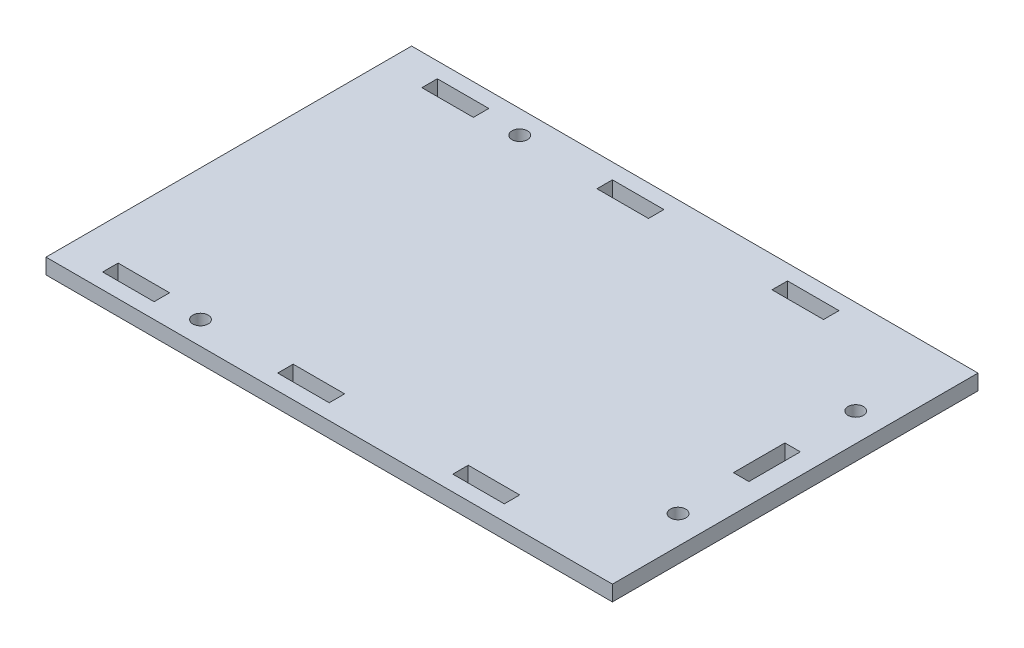
from build123d import *

# Parameters (mm, degrees)
SKETCH1_W           = 110
SKETCH1_H           = 71
SKETCH1_R           = 1.5
SKETCH1_W_2         = 10
SKETCH1_H_2         = 3
SKETCH1_W_3         = 3
SKETCH1_H_3         = 10
BOSS_EXTRUDE1_DEPTH = 3


with BuildPart() as part:
    # Sketch1 → Boss-Extrude1 (new body)
    with BuildSketch(Plane(origin=(0, 0, 0), x_dir=(1, 0, 0), z_dir=(0, 1, 0))):
        with Locations((-55, 35.5)):
            Rectangle(SKETCH1_W, SKETCH1_H)
        with Locations(Location((-5.5, 18.25, 0), (0, 0, 270))):
            Circle(SKETCH1_R, mode=Mode.SUBTRACT)
        with Locations(Location((-5.5, 52.75, 0), (0, 0, 90))):
            Circle(SKETCH1_R, mode=Mode.SUBTRACT)
        with Locations(Location((-84.5, 4.5, 0), (0, 0, 270))):
            Circle(SKETCH1_R, mode=Mode.SUBTRACT)
        with Locations(Location((-84.5, 66.5, 0), (0, 0, 90))):
            Circle(SKETCH1_R, mode=Mode.SUBTRACT)
        with Locations((-63, 4.5)):
            Rectangle(SKETCH1_W_2, SKETCH1_H_2, mode=Mode.SUBTRACT)
        with Locations((-5.5, 35.5)):
            Rectangle(SKETCH1_W_3, SKETCH1_H_3, mode=Mode.SUBTRACT)
        with Locations((-29, 4.5)):
            Rectangle(SKETCH1_W_2, SKETCH1_H_2, mode=Mode.SUBTRACT)
        with Locations((-97, 4.5)):
            Rectangle(SKETCH1_W_2, SKETCH1_H_2, mode=Mode.SUBTRACT)
        with Locations((-29, 66.5)):
            Rectangle(SKETCH1_W_2, SKETCH1_H_2, mode=Mode.SUBTRACT)
        with Locations((-63, 66.5)):
            Rectangle(SKETCH1_W_2, SKETCH1_H_2, mode=Mode.SUBTRACT)
        with Locations((-97, 66.5)):
            Rectangle(SKETCH1_W_2, SKETCH1_H_2, mode=Mode.SUBTRACT)
    extrude(amount=BOSS_EXTRUDE1_DEPTH)


solid = part.part
